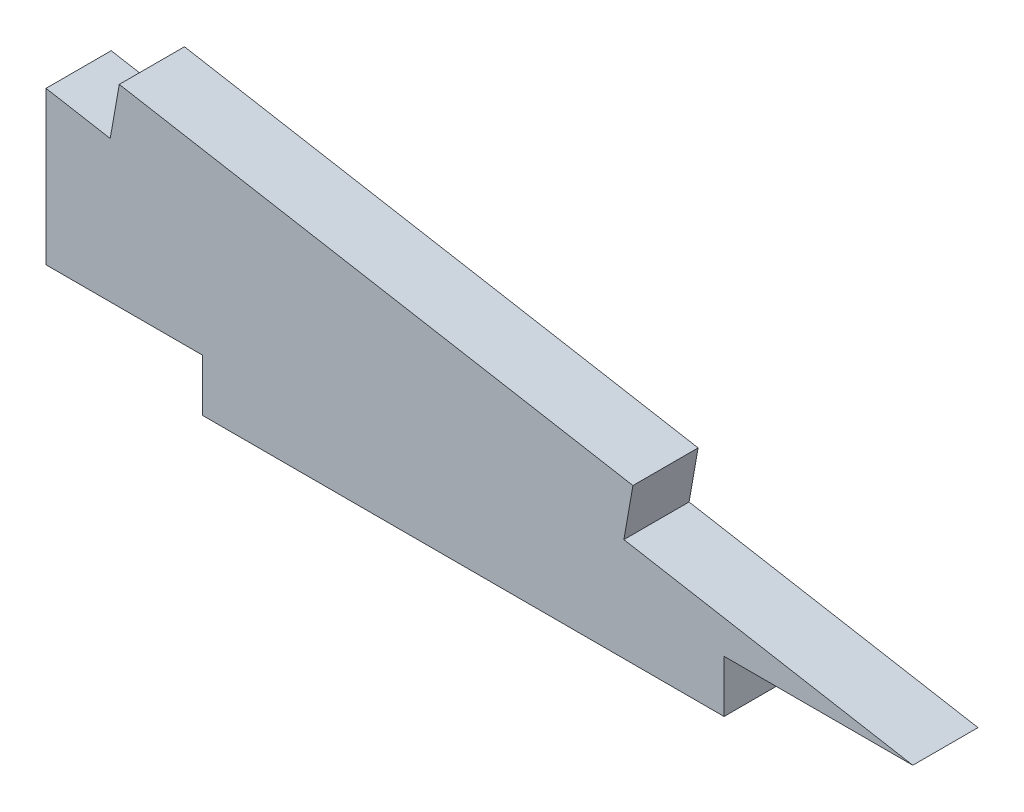
from build123d import *

# Parameters (mm, degrees)
EXTRUDE_1_DEPTH = 5


with BuildPart() as part:
    # 草图1 → 凸台-拉伸1 (new body)
    with BuildSketch(Plane.XY):
        Polygon((-22.45174375, 2.921828866), (-22.45174375, 6.921828866), (-34.45174375, 6.921828866), (-34.45174375, 18.643080859), (-29.527704985, 17.77483997), (-28.833112274, 21.714070982), (10.559197847, 14.768143876), (9.864605136, 10.828912864), (20.943692357, 8.875370865), (32.022779579, 6.921828866), (24.785517914, 6.921828866), (17.54825625, 6.921828866), (17.54825625, 2.921828866), align=None)
    extrude(amount=EXTRUDE_1_DEPTH)


solid = part.part
